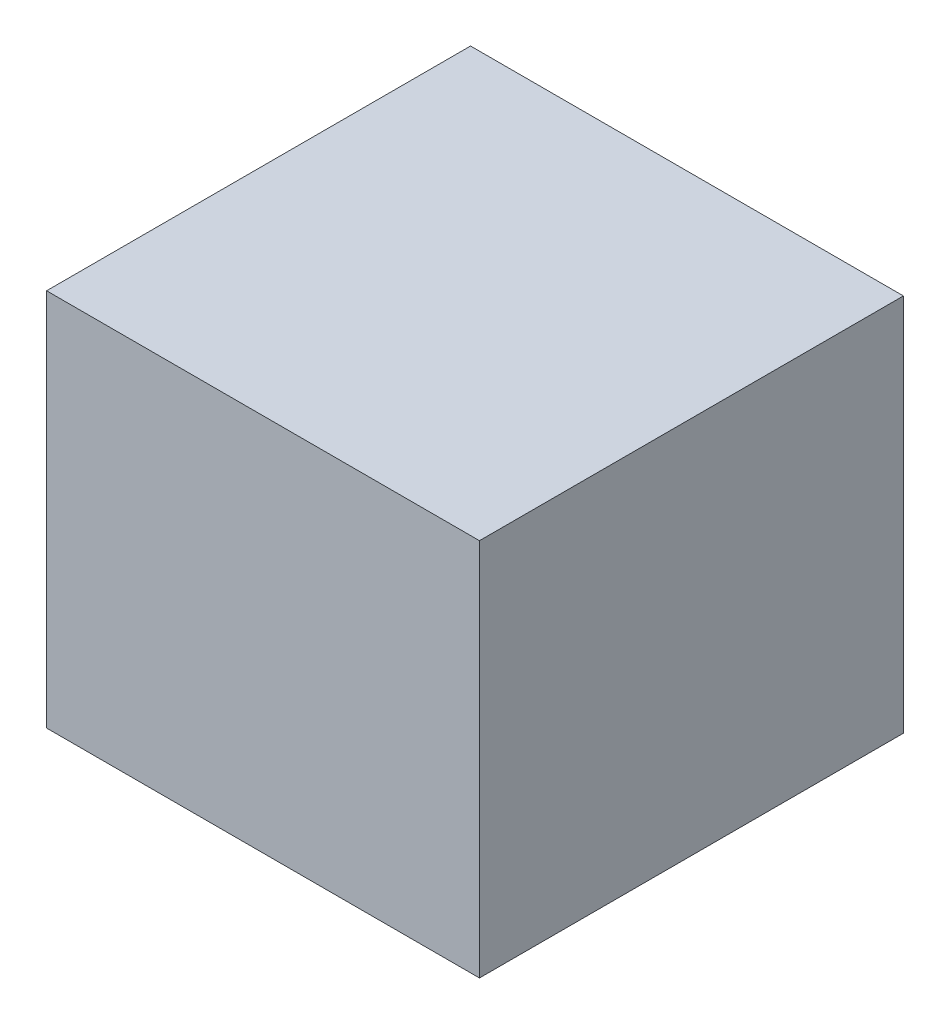
from build123d import *

# Parameters (mm, degrees)
SKETCH1_W           = 0.132217105
SKETCH1_H           = 0.118113947
BOSS_EXTRUDE1_DEPTH = 0.135


with BuildPart() as part:
    # Sketch1 → Boss-Extrude1 (new body)
    with BuildSketch(Plane(origin=(-13.793471613, 0, 0), x_dir=(0, 0, -1), z_dir=(1, 0, 0))):
        with Locations((-27.009764135, -29.11579768)):
            Rectangle(SKETCH1_W, SKETCH1_H)
    extrude(amount=BOSS_EXTRUDE1_DEPTH)


solid = part.part
